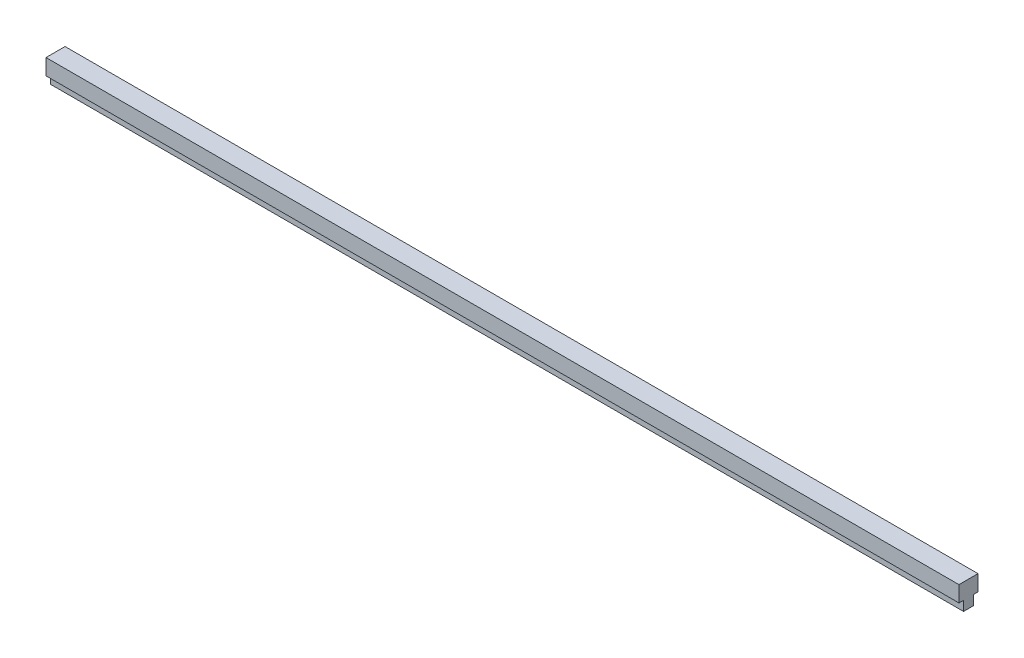
from build123d import *

# Parameters (mm, degrees)
EXTRUDE_1_DEPTH = 575


with BuildPart() as part:
    # 草图1 → 凸台-拉伸1 (new body)
    with BuildSketch(Plane(origin=(0, 0, 0), x_dir=(0, 0, -1), z_dir=(1, 0, 0))):
        Polygon((0, 6.1), (2.9, 6.1), (2.9, 16.1), (-9.1, 16.1), (-9.1, 6.1), (-6.2, 6.1), (-6.2, 0), (0, 0), align=None)
    extrude(amount=EXTRUDE_1_DEPTH)


solid = part.part
